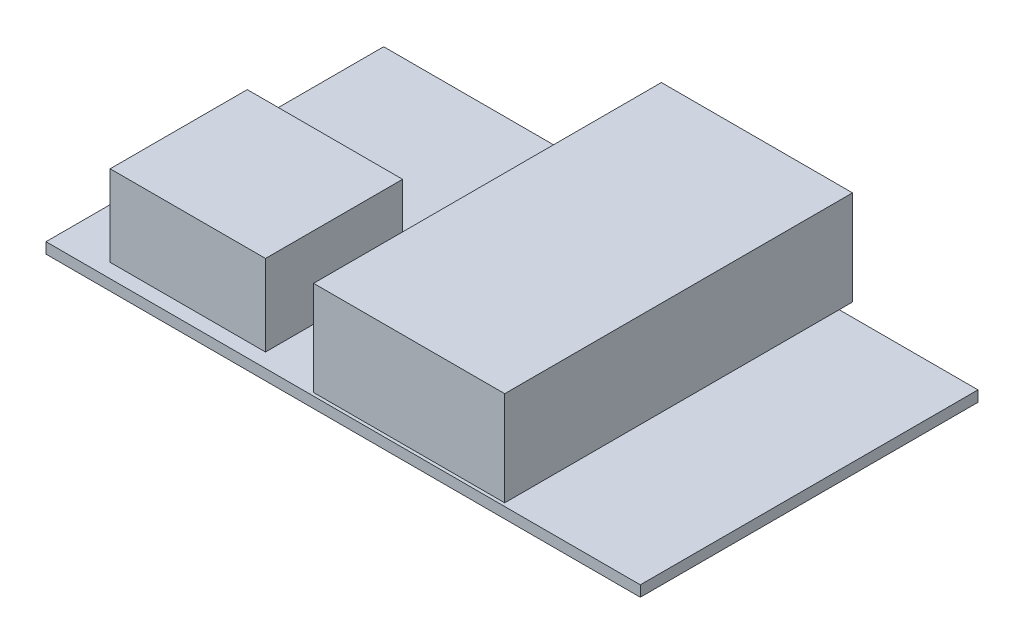
from build123d import *

# Parameters (mm, degrees)
CROQUIS_PCB_W    = 88
CROQUIS_PCB_H    = 50
PCB_DEPTH        = 1.6
CROQUIS_ESP32_W  = 28.3
CROQUIS_ESP32_H  = 51.5
ESP32_DEPTH      = 14
CROQUIS_INA219_W = 23
CROQUIS_INA219_H = 20.3
INA219_DEPTH     = 12


with BuildPart() as part:
    # Croquis_pcb → PCB (new body)
    with BuildSketch(Plane(origin=(0, 0, 0), x_dir=(1, 0, 0), z_dir=(0, 1, 0))):
        Rectangle(CROQUIS_PCB_W, CROQUIS_PCB_H)
    extrude(amount=PCB_DEPTH)

    # Croquis_esp32 → ESP32 (add)
    with BuildSketch(Plane(origin=(0, 1.6, 0), x_dir=(1, 0, 0), z_dir=(0, 1, 0))):
        with Locations((9.3, 1.22)):
            Rectangle(CROQUIS_ESP32_W, CROQUIS_ESP32_H)
    extrude(amount=ESP32_DEPTH)

    # Croquis_ina219 → INA219 (add)
    with BuildSketch(Plane(origin=(0, 1.6, 0), x_dir=(1, 0, 0), z_dir=(0, 1, 0))):
        with Locations((-25.1, -12.75)):
            Rectangle(CROQUIS_INA219_W, CROQUIS_INA219_H)
    extrude(amount=INA219_DEPTH)


solid = part.part
